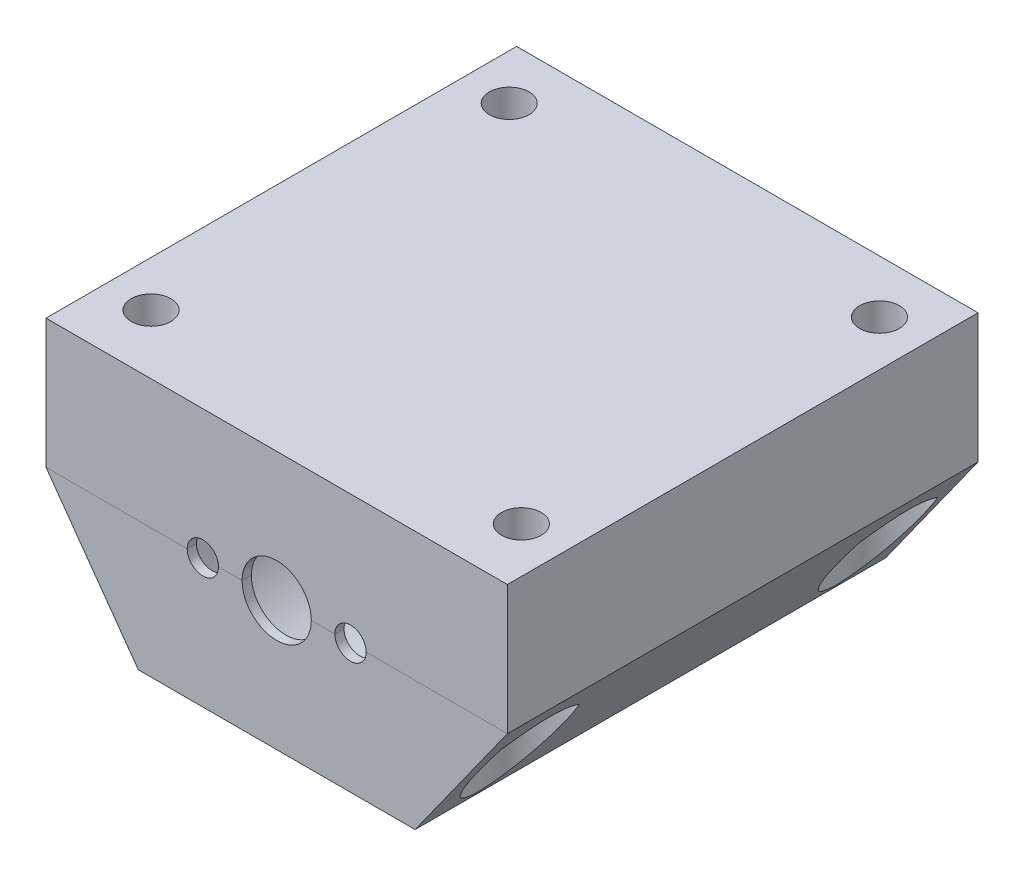
from build123d import *

# Parameters (mm, degrees)
ESQUISSE1_W                                 = 10
ESQUISSE1_H                                 = 14
ESQUISSE1_W_2                               = 30
ESQUISSE1_H_2                               = 28
ESQUISSE1_R                                 = 12.5
BOSS_EXTRU_1_DEPTH                          = 50
FRAISAGE_POUR_VIS_T_TE_FRAIS_E_M41_AT_COUNT = 2
FRAISAGE_POUR_VIS_T_TE_FRAIS_E_M41_AT_PITCH = 40.126930435
FRAISAGE_POUR_VIS_T_TE_FRAIS_E_M41_2_COUNT  = 2
FRAISAGE_POUR_VIS_T_TE_FRAIS_E_M41_2_PITCH  = 55.827168328
FRAISAGE_POUR_VIS_T_TE_FRAIS_E_M41_3_COUNT  = 2
FRAISAGE_POUR_VIS_T_TE_FRAIS_E_M41_3_PITCH  = 38.813685439
ESQUISSE26_R                                = 3.75
BOSS_EXTRU_2_DEPTH                          = 1
D_GAGEMENT_M31_D                            = 3.4


with BuildPart() as part:
    # Esquisse1 → Boss.-Extru.1 (new body)
    # profile 1 of 5: a face of its own
    with BuildSketch(Plane.XY):
        with Locations((-20, 7)):
            Rectangle(ESQUISSE1_W, ESQUISSE1_H)
    # profile 2 of 5: a face of its own
    with BuildSketch(Plane.XY):
        Polygon((-15, -14), (-15, 0), (-25, 0), align=None)
    # profile 3 of 5: a face of its own
    with BuildSketch(Plane.XY):
        Rectangle(ESQUISSE1_W_2, ESQUISSE1_H_2)
        Circle(ESQUISSE1_R, mode=Mode.SUBTRACT)
    # profile 4 of 5: a face of its own
    with BuildSketch(Plane.XY):
        Polygon((25, 0), (15, 0), (15, -14), align=None)
    # profile 5 of 5: a face of its own
    with BuildSketch(Plane.XY):
        with Locations((20, 7)):
            Rectangle(ESQUISSE1_W, ESQUISSE1_H)
    extrude(amount=BOSS_EXTRU_1_DEPTH)

    # Esquisse25 → Fraisage pour vis à tête fraisée M41 (revolve, cut)
    with BuildSketch(Plane(origin=(20.063465217, -14, 5.739073391), x_dir=(0, 0, -1), z_dir=(1, 0, 0))):
        Polygon((0, 0), (0, 28), (2.15, 28), (2.15, 12.55), (4.7, 10), (4.7, 0), align=None)
    fraisage_pour_vis_t_te_frais_e_m41 = revolve(axis=Axis((20.063465217, -20.35, 5.739073391), (0, 1, 0)), mode=Mode.SUBTRACT)

    # Fraisage pour vis à tête fraisée M41 at: Fraisage pour vis à tête fraisée M41 ×2
    with Locations(*[(-i * FRAISAGE_POUR_VIS_T_TE_FRAIS_E_M41_AT_PITCH, 0, 0) for i in range(1, FRAISAGE_POUR_VIS_T_TE_FRAIS_E_M41_AT_COUNT)]):
        add(fraisage_pour_vis_t_te_frais_e_m41, mode=Mode.SUBTRACT)

    # Fraisage pour vis _ t_te frais_e M41 2: Fraisage pour vis à tête fraisée M41 ×2
    with Locations(*[Vector(-0.7187706565997187, 0, 0.695247253292819) * (i * FRAISAGE_POUR_VIS_T_TE_FRAIS_E_M41_2_PITCH) for i in range(1, FRAISAGE_POUR_VIS_T_TE_FRAIS_E_M41_2_COUNT)]):
        add(fraisage_pour_vis_t_te_frais_e_m41, mode=Mode.SUBTRACT)

    # Fraisage pour vis _ t_te frais_e M41 3: Fraisage pour vis à tête fraisée M41 ×2
    with Locations(*[(0, 0, i * FRAISAGE_POUR_VIS_T_TE_FRAIS_E_M41_3_PITCH) for i in range(1, FRAISAGE_POUR_VIS_T_TE_FRAIS_E_M41_3_COUNT)]):
        add(fraisage_pour_vis_t_te_frais_e_m41, mode=Mode.SUBTRACT)

    # Esquisse26 → Boss.-Extru.2 (add)
    with BuildSketch(Plane.XY.offset(50)):
        Polygon((-25, 14), (-25, 0), (-15, -14), (15, -14), (25, 0), (25, 14), align=None)
        Circle(ESQUISSE26_R, mode=Mode.SUBTRACT)
    extrude(amount=BOSS_EXTRU_2_DEPTH)

    # Dégagement M31 (through all)
    with Locations(Plane.XY.offset(51)):
        with Locations((-8, 0), (8, 0)):
            Hole(D_GAGEMENT_M31_D / 2)


with BuildPart() as body_2:
    # Fractionner1: the piece on the far side of the plane
    add(part.part)
    split(bisect_by=Plane.ZX, keep=Keep.BOTTOM)


with BuildPart() as part_1:
    add(part.part)

    # Fractionner1
    split(bisect_by=Plane.ZX, keep=Keep.TOP)


solid = Compound([body_2.part, part_1.part])
